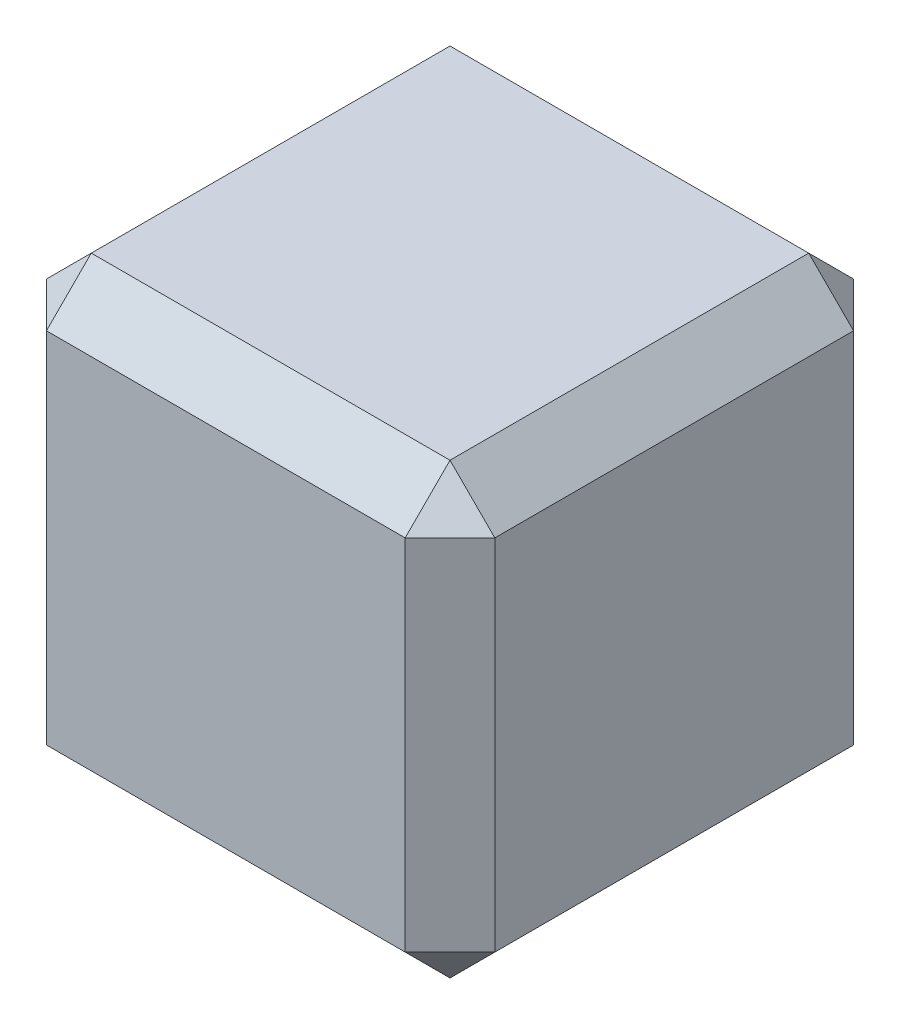
from build123d import *

# Parameters (mm, degrees)
SKETCH_1_W      = 120
SKETCH_1_H      = 120
EXTRUDE_1_DEPTH = 120
CHAMFER_1_SIZE  = 12


with BuildPart() as part:
    # 草图1 → 凸台-拉伸1 (new body)
    with BuildSketch(Plane(origin=(0, 0, 0), x_dir=(0, 0, -1), z_dir=(1, 0, 0))):
        with Locations((20.102245328, 28.139540774)):
            Rectangle(SKETCH_1_W, SKETCH_1_H)
    extrude(amount=EXTRUDE_1_DEPTH)

    # 倒角1
    chamfer_1_edges = [part.edges().sort_by_distance(p)[0] for p in [
        (60, 88.139540774, 39.897754672),
        (120, 28.139540774, 39.897754672),
        (60, -31.860459226, 39.897754672),
        (0, 28.139540774, 39.897754672),
        (60, -31.860459226, -80.102245328),
        (120, 88.139540774, -20.102245328),
        (120, -31.860459226, -20.102245328),
        (120, 28.139540774, -80.102245328),
        (60, 88.139540774, -80.102245328),
        (0, 88.139540774, -20.102245328),
        (0, 28.139540774, -80.102245328),
        (0, -31.860459226, -20.102245328),
    ]]
    chamfer(chamfer_1_edges, length=CHAMFER_1_SIZE)


solid = part.part
